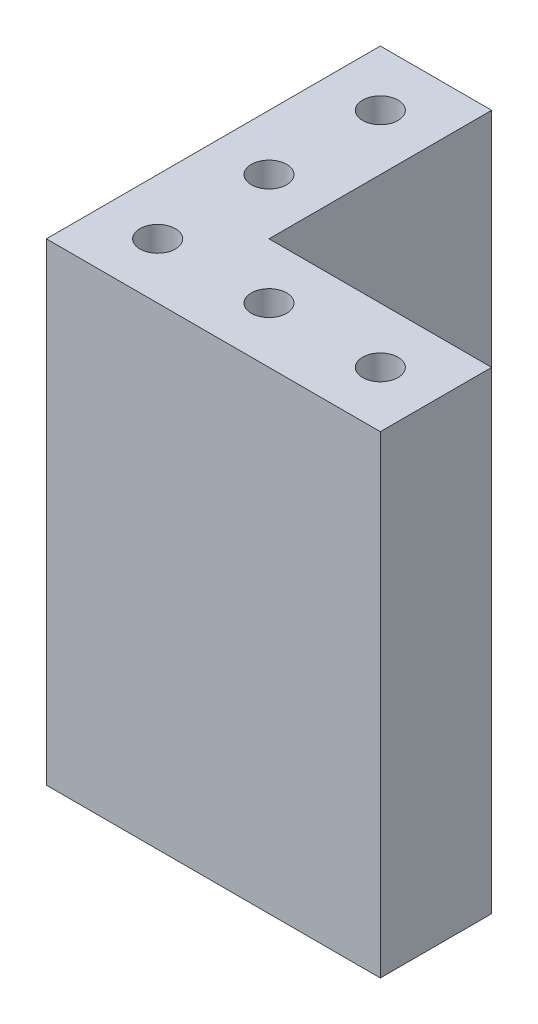
from build123d import *

# Parameters (mm, degrees)
SKETCH1_R           = 2.0193
BOSS_EXTRUDE1_DEPTH = 53.975


with BuildPart() as part:
    # Sketch1 → Boss-Extrude1 (new body)
    with BuildSketch(Plane(origin=(0, 0, 0), x_dir=(1, 0, 0), z_dir=(0, 1, 0))):
        Polygon((-6.35, -6.35), (31.75, -6.35), (31.75, 6.35), (6.35, 6.35), (6.35, 31.75), (-6.35, 31.75), align=None)
        with Locations(Location((0, 0, 0), (0, 0, 270))):
            Circle(SKETCH1_R, mode=Mode.SUBTRACT)
        with Locations(Location((12.7, 0, 0), (0, 0, 270))):
            Circle(SKETCH1_R, mode=Mode.SUBTRACT)
        with Locations(Location((25.4, 0, 0), (0, 0, 270))):
            Circle(SKETCH1_R, mode=Mode.SUBTRACT)
        with Locations(Location((0, 12.7, 0), (0, 0, 270))):
            Circle(SKETCH1_R, mode=Mode.SUBTRACT)
        with Locations(Location((0, 25.4, 0), (0, 0, 270))):
            Circle(SKETCH1_R, mode=Mode.SUBTRACT)
    extrude(amount=BOSS_EXTRUDE1_DEPTH)


solid = part.part
